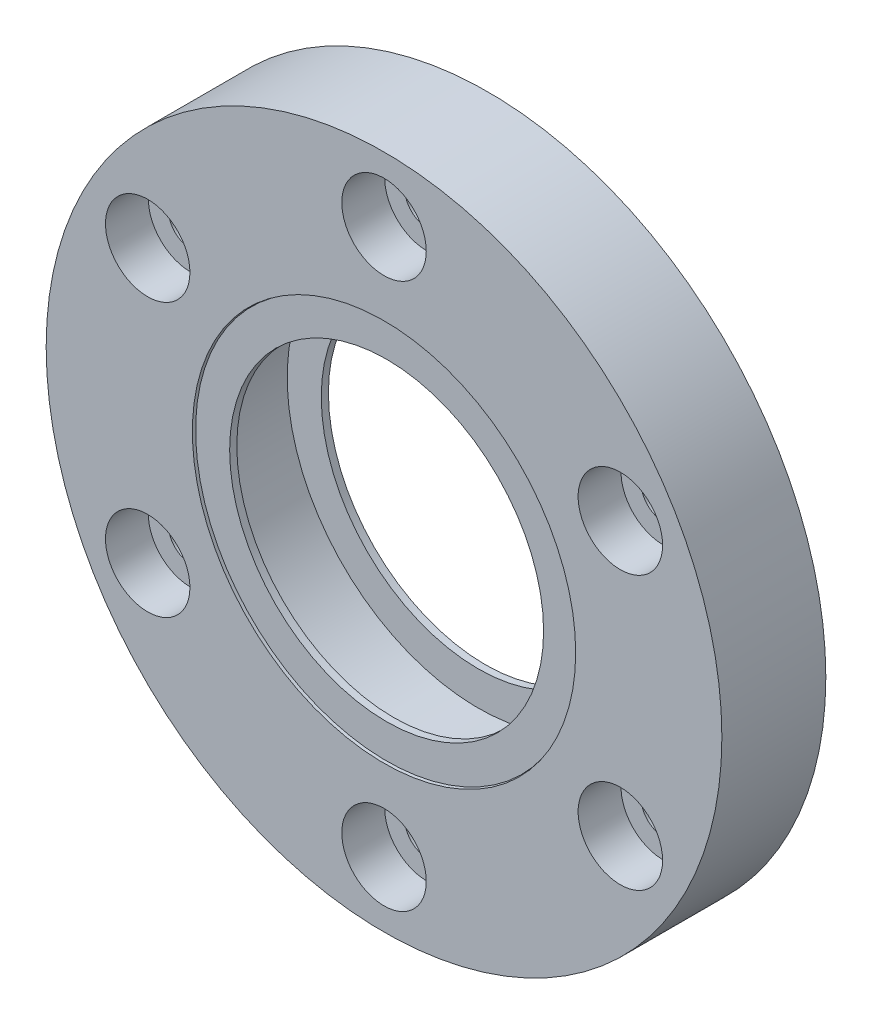
from build123d import *

# Parameters (mm, degrees)
D52_D29_5_8_2_R                    = 26
D52_D29_5_8_2_R_2                  = 14.75
D52_D29_5_8_DEPTH                  = 8
D10_D24_8_2_R                      = 12
D10_D24_8_2_R_2                    = 5
D10_D24_8_DEPTH                    = 8
F_6XD3_4_D6_5_3_3_PCD42_AT_2_COUNT = 2
F_6XD3_4_D6_5_3_3_PCD42_AT_2_PITCH = 21
F_6XD3_4_D6_5_3_3_PCD42_AT_3_COUNT = 2
F_6XD3_4_D6_5_3_3_PCD42_AT_3_PITCH = 36.373066959
F_6XD3_4_D6_5_3_3_PCD42_AT_4_COUNT = 2
F_6XD3_4_D6_5_3_3_PCD42_AT_4_PITCH = 42
F_6XD3_4_D6_5_3_3_PCD42_AT_5_COUNT = 2
F_6XD3_4_D6_5_3_3_PCD42_AT_5_PITCH = 36.373066959
F_6XD3_4_D6_5_3_3_PCD42_AT_6_COUNT = 2
F_6XD3_4_D6_5_3_3_PCD42_AT_6_PITCH = 21
SKETCH_6_W                         = 1.25
SKETCH_6_H                         = 8
F_4XM3X0_5_PCD16_AT_2_COUNT        = 2
F_4XM3X0_5_PCD16_AT_2_PITCH        = 11.313708499
F_4XM3X0_5_PCD16_AT_3_COUNT        = 2
F_4XM3X0_5_PCD16_AT_3_PITCH        = 16
F_4XM3X0_5_PCD16_AT_4_COUNT        = 2
F_4XM3X0_5_PCD16_AT_4_PITCH        = 11.313708499
EXTRUDE_START                      = 7.25
SKETCH_2032_R                      = 14.7
SKETCH_2032_R_2                    = 12.08
EXTRUDE_2043_DEPTH                 = 0.55
EXTRUDE_START_2                    = 0.2
SKETCH_2080_R                      = 14.7
SKETCH_2080_R_2                    = 12.08
EXTRUDE_2091_DEPTH                 = 0.55


with BuildPart() as part:
    # D52__D29.5__8 2 → D52__D29.5__8 (new body)
    with BuildSketch(Plane.XY):
        Circle(D52_D29_5_8_2_R)
        Circle(D52_D29_5_8_2_R_2, mode=Mode.SUBTRACT)
    extrude(amount=D52_D29_5_8_DEPTH)

    # 草图4 → 外圈_6xD3.4通孔_D6.5沉孔深3.3_PCD42 (revolve, cut)
    with BuildSketch(Plane(origin=(18.186533479, 10.5, 8), x_dir=(0, -1, 0), z_dir=(1, 0, 0))):
        Polygon((0, 0), (0, 8), (1.7, 8), (1.7, 3.3), (3.25, 3.3), (3.25, 0), align=None)
    f_6xd3_4_d6_5_3_3_pcd42 = revolve(axis=Axis((18.186533479, 10.5, 14.35), (0, 0, -1)), mode=Mode.SUBTRACT)

    # 外圈_6xD3.4通孔_D6.5沉孔深3.3_PCD42 at 2: 外圈_6xD3.4通孔_D6.5沉孔深3.3_PCD42 ×2
    with Locations(*[(0, -i * F_6XD3_4_D6_5_3_3_PCD42_AT_2_PITCH, 0) for i in range(1, F_6XD3_4_D6_5_3_3_PCD42_AT_2_COUNT)]):
        add(f_6xd3_4_d6_5_3_3_pcd42, mode=Mode.SUBTRACT)

    # 外圈_6xD3.4通孔_D6.5沉孔深3.3_PCD42 at 3: 外圈_6xD3.4通孔_D6.5沉孔深3.3_PCD42 ×2
    with Locations(*[Vector(-0.5000000000000001, -0.8660254037844386, 0) * (i * F_6XD3_4_D6_5_3_3_PCD42_AT_3_PITCH) for i in range(1, F_6XD3_4_D6_5_3_3_PCD42_AT_3_COUNT)]):
        add(f_6xd3_4_d6_5_3_3_pcd42, mode=Mode.SUBTRACT)

    # 外圈_6xD3.4通孔_D6.5沉孔深3.3_PCD42 at 4: 外圈_6xD3.4通孔_D6.5沉孔深3.3_PCD42 ×2
    with Locations(*[Vector(-0.8660254037844387, -0.49999999999999983, 0) * (i * F_6XD3_4_D6_5_3_3_PCD42_AT_4_PITCH) for i in range(1, F_6XD3_4_D6_5_3_3_PCD42_AT_4_COUNT)]):
        add(f_6xd3_4_d6_5_3_3_pcd42, mode=Mode.SUBTRACT)

    # 外圈_6xD3.4通孔_D6.5沉孔深3.3_PCD42 at 5: 外圈_6xD3.4通孔_D6.5沉孔深3.3_PCD42 ×2
    with Locations(*[(-i * F_6XD3_4_D6_5_3_3_PCD42_AT_5_PITCH, 0, 0) for i in range(1, F_6XD3_4_D6_5_3_3_PCD42_AT_5_COUNT)]):
        add(f_6xd3_4_d6_5_3_3_pcd42, mode=Mode.SUBTRACT)

    # 外圈_6xD3.4通孔_D6.5沉孔深3.3_PCD42 at 6: 外圈_6xD3.4通孔_D6.5沉孔深3.3_PCD42 ×2
    with Locations(*[Vector(-0.8660254037844387, 0.5, 0) * (i * F_6XD3_4_D6_5_3_3_PCD42_AT_6_PITCH) for i in range(1, F_6XD3_4_D6_5_3_3_PCD42_AT_6_COUNT)]):
        add(f_6xd3_4_d6_5_3_3_pcd42, mode=Mode.SUBTRACT)


with BuildPart() as body_2:
    # D10__D24__8 2 → D10__D24__8 (new body)
    with BuildSketch(Plane.XY):
        Circle(D10_D24_8_2_R)
        Circle(D10_D24_8_2_R_2, mode=Mode.SUBTRACT)
    extrude(amount=D10_D24_8_DEPTH)

    # 草图6 → 内圈_4xM3x0.5通螺纹_PCD16 (revolve, cut)
    with BuildSketch(Plane(origin=(5.656854249, -5.656854249, 8), x_dir=(0, -1, 0), z_dir=(1, 0, 0))):
        with Locations((0.625, 4)):
            Rectangle(SKETCH_6_W, SKETCH_6_H)
    f_4xm3x0_5_pcd16 = revolve(axis=Axis((5.656854249, -5.656854249, 14.35), (0, 0, -1)), mode=Mode.SUBTRACT)

    # 内圈_4xM3x0.5通螺纹_PCD16 at 2: 内圈_4xM3x0.5通螺纹_PCD16 ×2
    with Locations(*[(-i * F_4XM3X0_5_PCD16_AT_2_PITCH, 0, 0) for i in range(1, F_4XM3X0_5_PCD16_AT_2_COUNT)]):
        add(f_4xm3x0_5_pcd16, mode=Mode.SUBTRACT)

    # 内圈_4xM3x0.5通螺纹_PCD16 at 3: 内圈_4xM3x0.5通螺纹_PCD16 ×2
    with Locations(*[Vector(-0.7071067811865475, 0.7071067811865477, 0) * (i * F_4XM3X0_5_PCD16_AT_3_PITCH) for i in range(1, F_4XM3X0_5_PCD16_AT_3_COUNT)]):
        add(f_4xm3x0_5_pcd16, mode=Mode.SUBTRACT)

    # 内圈_4xM3x0.5通螺纹_PCD16 at 4: 内圈_4xM3x0.5通螺纹_PCD16 ×2
    with Locations(*[(0, i * F_4XM3X0_5_PCD16_AT_4_PITCH, 0) for i in range(1, F_4XM3X0_5_PCD16_AT_4_COUNT)]):
        add(f_4xm3x0_5_pcd16, mode=Mode.SUBTRACT)


with BuildPart() as body_3:
    # Sketch 2032 → Extrude 2043 (new body)
    with BuildSketch(Plane.XY.offset(EXTRUDE_START)):
        Circle(SKETCH_2032_R)
        Circle(SKETCH_2032_R_2, mode=Mode.SUBTRACT)
    extrude(amount=EXTRUDE_2043_DEPTH)


with BuildPart() as body_4:
    # Sketch 2080 → Extrude 2091 (new body)
    with BuildSketch(Plane.XY.offset(EXTRUDE_START_2)):
        Circle(SKETCH_2080_R)
        Circle(SKETCH_2080_R_2, mode=Mode.SUBTRACT)
    extrude(amount=EXTRUDE_2091_DEPTH)


solid = Compound([part.part, body_3.part, body_4.part])
